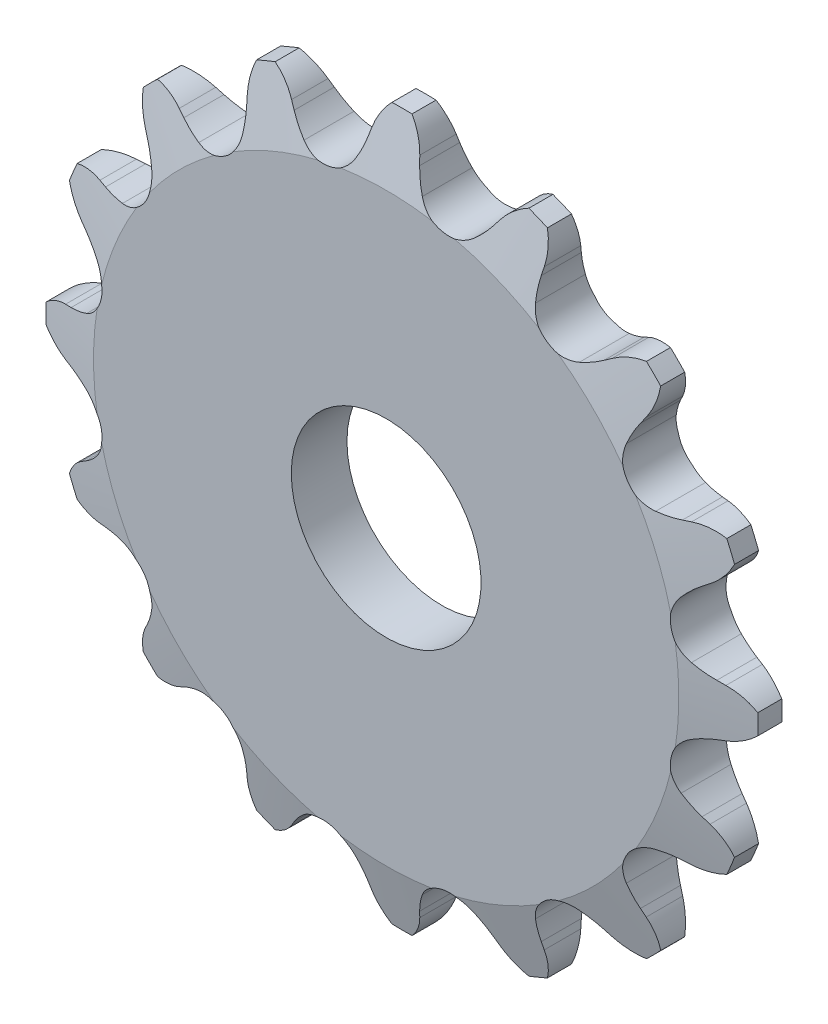
from build123d import *

# Parameters (mm, degrees)
CUT_EXTRUDE1_DEPTH      = 26.306064487
CIRPATTERN1_COUNT       = 16
BOSS_EXTRUDE1_START     = 1.397
SKETCH2_R               = 12.303125
BOSS_EXTRUDE1_DEPTH     = 9.906
CUT_EXTRUDE2_DEPTH      = 28.68037404
CUT_EXTRUDE2_DEPTH_BACK = 28.68037404
SKETCH3_OUTSIDE_W       = 48.156
SKETCH3_OUTSIDE_H       = 48.156
SKETCH3_OUTSIDE_R       = 17.907
SKETCH3_OUTSIDE_R_2     = 4.7625
SKETCH4_W               = 1.74625
SKETCH4_H               = 5.461
CUT_EXTRUDE4_REACH      = 38.84
CUT_EXTRUDE4_END_RADIUS = 4.7625
SKETCH6_R               = 2.38125
CUT_SWEEP1_PITCH        = 1.27
CUT_SWEEP1_HEIGHT       = 13.573125
CUT_SWEEP1_RADIUS       = 3.175
CUT_SWEEP1_START_ANGLE  = -180
CUT_EXTRUDE5_START      = -37.840263504
SKETCH9_R               = 3.312481533
CUT_EXTRUDE5_DEPTH      = 39.110263504
CIRPATTERN2_COUNT       = 2
CIRPATTERN2_ANGLE       = 90
CUT_EXTRUDE9_START      = -9.906
SKETCH15_R              = 12.303125
CUT_EXTRUDE9_DEPTH      = 9.906


with BuildPart() as part:
    # Sketch1 → Revolve1 (revolve)
    with BuildSketch(Plane(origin=(0, 0, 0), x_dir=(0, 0, -1), z_dir=(1, 0, 0)), mode=Mode.PRIVATE) as revolve1_sk:
        Polygon((1.397, 0), (-1.397, 0), (-1.397, 14.691802887), (-0.60325, 17.866802887), (0.60325, 17.866802887), (1.397, 14.691802887), align=None)
    revolve(revolve1_sk.sketch.rotate(Axis((0, 0, -1.397), (0, 0, 1)), 90), axis=Axis((0, 0, -1.397), (0, 0, 1)))

    # Sketch0 → Cut-Extrude1 (cut, symmetric)
    with BuildSketch(Plane.XY):
        with BuildLine():
            Line((5.229218869, -15.77388455), (5.009422849, -15.465741895))
            ThreePointArc((5.009422849, -15.465741895), (4.663204574, -15.0401), (4.266038763, -14.661553522))
            ThreePointArc((4.266038763, -14.661553522), (2.843862466, -14.297062088), (1.669427727, -15.17805157))
            ThreePointArc((1.669427727, -15.17805157), (1.447357829, -15.679771689), (1.290379952, -16.205505522))
            Line((1.290379952, -16.205505522), (1.205235997, -16.574304509))
            ThreePointArc((1.205235997, -16.574304509), (0.149118895, -18.16716188), (-1.693761215, -18.673492641))
            ThreePointArc((-1.693761215, -18.673492641), (3.657972955, -18.389871896), (8.710867577, -16.603883297))
            ThreePointArc((8.710867577, -16.603883297), (6.81450397, -16.841334355), (5.229218869, -15.77388455))
        make_face()
    cut_extrude1 = extrude(amount=CUT_EXTRUDE1_DEPTH, both=True, mode=Mode.SUBTRACT)

    # CirPattern1: Cut-Extrude1 ×16 about axis
    cirpattern1_axis = Axis((0, 0, 0), (0, 0, 1))
    for i in range(1, CIRPATTERN1_COUNT):
        add(cut_extrude1.rotate(cirpattern1_axis, i * 360 / CIRPATTERN1_COUNT), mode=Mode.SUBTRACT)

    # Sketch2 → Boss-Extrude1 (add)
    with BuildSketch(Plane.XY.offset(BOSS_EXTRUDE1_START)):
        Circle(SKETCH2_R)
    extrude(amount=BOSS_EXTRUDE1_DEPTH)

    # Sketch3 outside → Cut-Extrude2 (cut, two sides: drawn at the far end of the back side and taken through both)
    # profile 1 of 2: a face of its own
    with BuildSketch(Plane.XY.offset(-CUT_EXTRUDE2_DEPTH_BACK)):
        Rectangle(SKETCH3_OUTSIDE_W, SKETCH3_OUTSIDE_H)
        Circle(SKETCH3_OUTSIDE_R, mode=Mode.SUBTRACT)
    # profile 2 of 2: a face of its own
    with BuildSketch(Plane.XY.offset(-CUT_EXTRUDE2_DEPTH_BACK)):
        with Locations(Location((0, 0, 0), (0, 0, 180))):
            Circle(SKETCH3_OUTSIDE_R_2)
    extrude(amount=CUT_EXTRUDE2_DEPTH + CUT_EXTRUDE2_DEPTH_BACK, mode=Mode.SUBTRACT)

    # Sketch4 → Cut-Revolve1 (revolve, cut)
    with BuildSketch(Plane(origin=(0, 0, 0), x_dir=(0, 0, -1), z_dir=(1, 0, 0))):
        Polygon((-11.303, 12.303125), (-11.303, 11.668125), (-10.668, 12.303125), align=None)
        with Locations((-2.270125, 15.136302887)):
            Rectangle(SKETCH4_W, SKETCH4_H)
    revolve(axis=Axis((0, 0, -1.397), (0, 0, 1)), mode=Mode.SUBTRACT)

    # Cut-Extrude4: up to this cylinder (the profile starts outside it)
    cut_extrude4_end = Plane(origin=(0, 0, 6.5405), z_dir=(0, 0, -1)) * Cylinder(CUT_EXTRUDE4_END_RADIUS, 88.205, mode=Mode.PRIVATE)
    # Sketch6 → Cut-Extrude4 (cut, up to the surface)
    with BuildSketch(Plane(origin=(0, 12.303125, 0), x_dir=(-1, 0, 0), z_dir=(0, 1, 0)), mode=Mode.PRIVATE) as cut_extrude4_sk1:
        with Locations(Location((0, 6.5405, 0), (0, 0, 90))):
            Circle(SKETCH6_R)
    cut_extrude4_tool1 = extrude(cut_extrude4_sk1.sketch, amount=-CUT_EXTRUDE4_REACH, mode=Mode.PRIVATE) - cut_extrude4_end
    cut_extrude4 = cut_extrude4_tool1.solids().sort_by_distance((0, 12.303125, 6.5405))[0]
    add(cut_extrude4, mode=Mode.SUBTRACT)

    # Cut-Sweep1: sweep along a helix
    with BuildLine() as cut_sweep1_path:
        add(Helix(CUT_SWEEP1_PITCH, CUT_SWEEP1_HEIGHT, CUT_SWEEP1_RADIUS, center=(0, 12.303125, 6.5405), direction=(0, -1, 0), mode=Mode.PRIVATE).rotate(Axis((0, 12.303125, 6.5405), (0, -1, 0)), CUT_SWEEP1_START_ANGLE))
    # Sketch8 → Cut-Sweep1 (sweep, cut)
    with BuildSketch(Plane(origin=(0, 0, 0), x_dir=(0, 0, -1), z_dir=(1, 0, 0))):
        Polygon((-9.7155, 12.85875), (-9.7155, 13.0175), (-8.821870036, 13.5334375), (-8.821870036, 12.3428125), align=None)
    cut_sweep1 = sweep(path=cut_sweep1_path.line, is_frenet=True, mode=Mode.SUBTRACT)

    # Sketch9 → Cut-Extrude5 (cut)
    with BuildSketch(Plane(origin=(0, 12.303125, 0), x_dir=(-1, 0, 0), z_dir=(0, 1, 0)).offset(CUT_EXTRUDE5_START)):
        with Locations((0, 6.5405)):
            Circle(SKETCH9_R)
    cut_extrude5 = extrude(amount=CUT_EXTRUDE5_DEPTH, mode=Mode.SUBTRACT)

    # CirPattern2: Cut-Extrude4, Cut-Sweep1, Cut-Extrude5 ×2 about axis
    cirpattern2_axis = Axis((0, 0, 11.303), (0, 0, -1))
    add([cut_extrude4.rotate(cirpattern2_axis, i * CIRPATTERN2_ANGLE / (CIRPATTERN2_COUNT - 1)) for i in range(1, CIRPATTERN2_COUNT)], mode=Mode.SUBTRACT)
    add([cut_sweep1.rotate(cirpattern2_axis, i * CIRPATTERN2_ANGLE / (CIRPATTERN2_COUNT - 1)) for i in range(1, CIRPATTERN2_COUNT)], mode=Mode.SUBTRACT)
    add([cut_extrude5.rotate(cirpattern2_axis, i * CIRPATTERN2_ANGLE / (CIRPATTERN2_COUNT - 1)) for i in range(1, CIRPATTERN2_COUNT)], mode=Mode.SUBTRACT)

    # Sketch15 → Cut-Extrude9 (cut)
    with BuildSketch(Plane.XY.offset(11.303).offset(CUT_EXTRUDE9_START)):
        Circle(SKETCH15_R)
    extrude(amount=CUT_EXTRUDE9_DEPTH, mode=Mode.SUBTRACT)


solid = part.part
